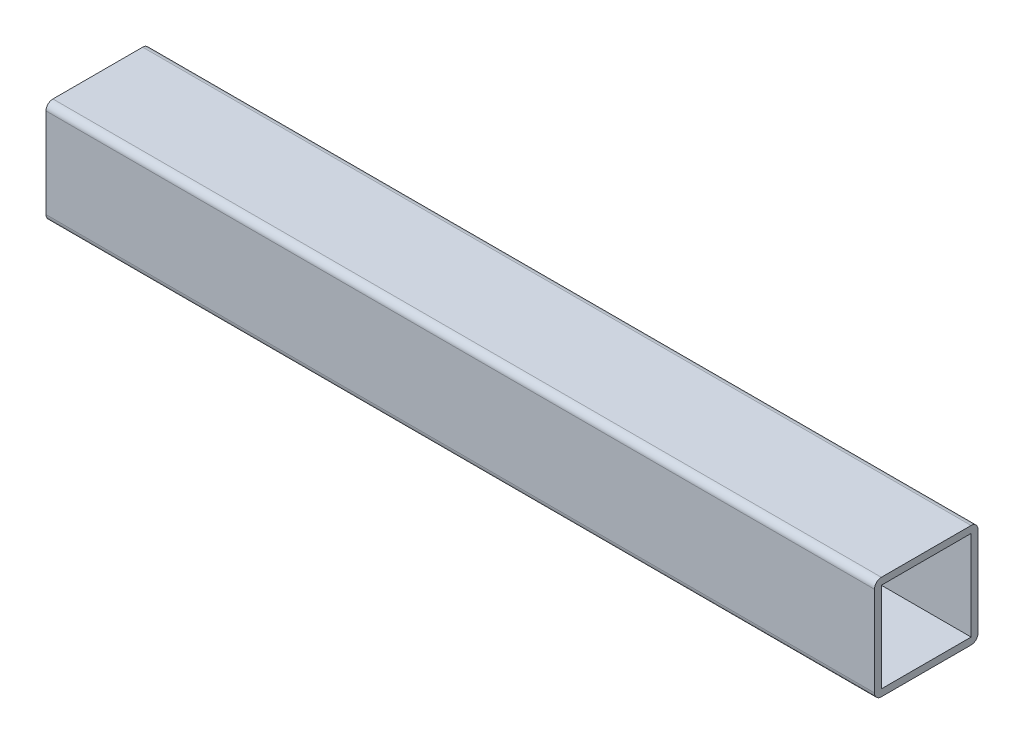
from build123d import *

# Parameters (mm, degrees)
SKETCH1_W      = 130
SKETCH1_H      = 130
EXTRUDE1_DEPTH = 1200


with BuildPart() as part:
    # Sketch1 → Extrude1 (new body)
    with BuildSketch(Plane(origin=(0, 0, 0), x_dir=(0, 0, -1), z_dir=(1, 0, 0))):
        with BuildLine():
            Line((10, 0), (140, 0))
            ThreePointArc((140, 0), (147.071067812, 2.928932188), (150, 10))
            Line((150, 10), (150, 140))
            ThreePointArc((150, 140), (147.071067812, 147.071067812), (140, 150))
            Line((140, 150), (10, 150))
            ThreePointArc((10, 150), (2.928932188, 147.071067812), (0, 140))
            Line((0, 140), (0, 10))
            ThreePointArc((0, 10), (2.928932188, 2.928932188), (10, 0))
        make_face()
        with Locations((75, 75)):
            Rectangle(SKETCH1_W, SKETCH1_H, mode=Mode.SUBTRACT)
    extrude(amount=EXTRUDE1_DEPTH)


solid = part.part
